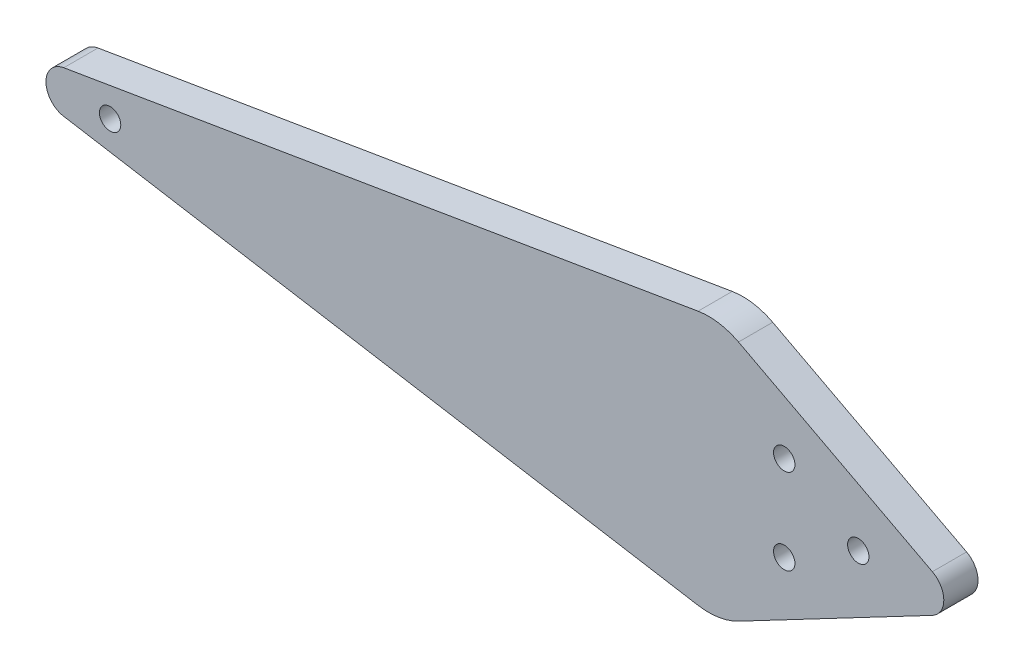
from build123d import *

# Parameters (mm, degrees)
SKETCH_1_R      = 2.5
EXTRUDE_1_DEPTH = 8


with BuildPart() as part:
    # 草图1 → 凸台-拉伸1 (new body)
    with BuildSketch(Plane.XY):
        with BuildLine():
            Line((-100.826455741, 4.931224078), (47.520632777, 29.793672234))
            ThreePointArc((47.520632777, 29.793672234), (52.376150378, 29.81060125), (56.982686096, 28.27562032))
            Line((56.982686096, 28.27562032), (102.327562032, 4.425206773))
            ThreePointArc((102.327562032, 4.425206773), (105, 0), (102.327562032, -4.425206773))
            Line((102.327562032, -4.425206773), (56.982686096, -28.27562032))
            ThreePointArc((56.982686096, -28.27562032), (52.376150378, -29.81060125), (47.520632777, -29.793672234))
            Line((47.520632777, -29.793672234), (-100.826455741, -4.931224078))
            ThreePointArc((-100.826455741, -4.931224078), (-105, 0), (-100.826455741, 4.931224078))
        make_face()
        with Locations((85, 0)):
            Circle(SKETCH_1_R, mode=Mode.SUBTRACT)
        with Locations((67.679491924, 10)):
            Circle(SKETCH_1_R, mode=Mode.SUBTRACT)
        with Locations(Location((67.679491924, -10, 0), (0, 0, 180))):
            Circle(SKETCH_1_R, mode=Mode.SUBTRACT)
        with Locations((-90, 0)):
            Circle(SKETCH_1_R, mode=Mode.SUBTRACT)
    extrude(amount=EXTRUDE_1_DEPTH)


solid = part.part
